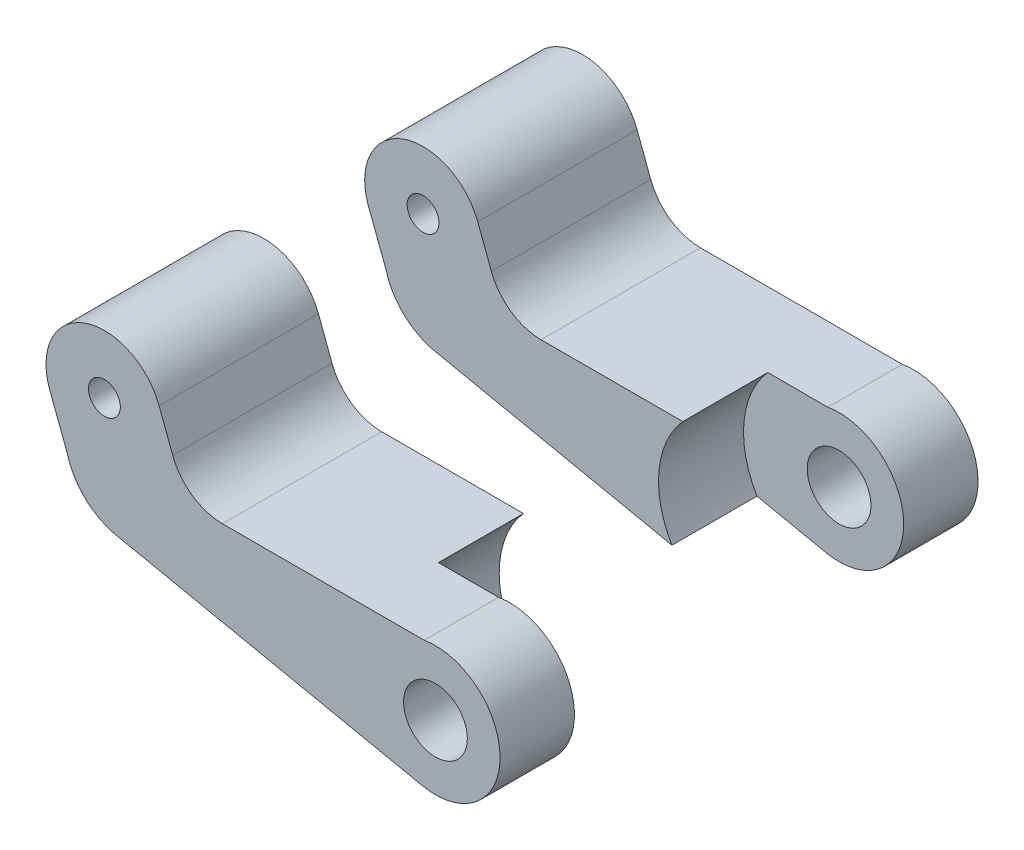
from build123d import *

# Parameters (mm, degrees)
BOSS_EXTRUDE2_DEPTH     = 15
SKETCH7_R               = 1.5
CUT_EXTRUDE1_DEPTH      = 18
CUT_EXTRUDE3_DEPTH      = 69
CUT_EXTRUDE3_DEPTH_BACK = 8
SKETCH12_R              = 9
CUT_EXTRUDE4_START      = -8
SKETCH13_R              = 9
CUT_EXTRUDE4_DEPTH      = 8
CUT_EXTRUDE5_DEPTH      = 10
CUT_EXTRUDE5_DEPTH_BACK = 48
SKETCH14_R              = 3


with BuildPart() as part:
    # Sketch3 → Boss-Extrude2 (new body)
    with BuildSketch(Plane.XY):
        with BuildLine():
            Line((-15.110783356, 40.907999924), (-13.834269034, 37.510363732))
            ThreePointArc((-13.834269034, 37.510363732), (-12.000412792, 35.158370297), (-9.15371136, 34.268880114))
            Line((-9.15371136, 34.268880114), (9.846529055, 34.268880114))
            ThreePointArc((9.846529055, 34.268880114), (16.986915334, 28.185418753), (9.662855904, 22.324380295))
            Line((9.662855904, 22.324380295), (-18.79366315, 28.260093131))
            ThreePointArc((-18.79366315, 28.260093131), (-21.953247193, 29.760673649), (-23.769791608, 32.749800546))
            Line((-23.769791608, 32.749800546), (-25.408010237, 37.039263884))
            ThreePointArc((-25.408010237, 37.039263884), (-22.193764817, 44.122245345), (-15.110783356, 40.907999924))
        make_face()
    extrude(amount=BOSS_EXTRUDE2_DEPTH)

    # Sketch7 → Cut-Extrude1 (cut)
    with BuildSketch(Plane.XY.offset(15)):
        with Locations((-20.259396796, 38.973631904)):
            Circle(SKETCH7_R)
    extrude(amount=-CUT_EXTRUDE1_DEPTH, mode=Mode.SUBTRACT)


with BuildPart() as body_2:
    # Body-Move/Copy1: copy of part
    add(part.part.moved(Location((0, 0, 30))))

    # Sketch13 → Cut-Extrude4 (cut)
    with BuildSketch(Plane(origin=(0, 0, 30), x_dir=(-1, 0, 0), z_dir=(0, 0, -1)).offset(CUT_EXTRUDE4_START)):
        with Locations((-10.904911352, 28.278943041)):
            Circle(SKETCH13_R)
    extrude(amount=CUT_EXTRUDE4_DEPTH, mode=Mode.SUBTRACT)


with BuildPart() as part_1:
    add(part.part)

    # Sketch12 → Cut-Extrude3 (cut, two sides: drawn at the far end of the back side and taken through both)
    with BuildSketch(Plane.XY.offset(15).offset(-CUT_EXTRUDE3_DEPTH_BACK)):
        with Locations((10.904911352, 28.278943041)):
            Circle(SKETCH12_R)
    extrude(amount=CUT_EXTRUDE3_DEPTH + CUT_EXTRUDE3_DEPTH_BACK, mode=Mode.SUBTRACT)


with BuildPart() as cut_extrude5_tool:
    # Sketch14 → Cut-Extrude5 (new, two sides: drawn at the far end of the back side and taken through both)
    with BuildSketch(Plane(origin=(0, 0, 0), x_dir=(-1, 0, 0), z_dir=(0, 0, -1)).offset(-CUT_EXTRUDE5_DEPTH_BACK)):
        with Locations(Location((-10.904911352, 28.278943041, 0), (0, 0, 180))):
            Circle(SKETCH14_R)
    extrude(amount=CUT_EXTRUDE5_DEPTH + CUT_EXTRUDE5_DEPTH_BACK)


with BuildPart() as part_2:
    add(part_1.part)

    # Cut-Extrude5: cut by cut_extrude5_tool
    add(cut_extrude5_tool.part, mode=Mode.SUBTRACT)


with BuildPart() as body_2_1:
    add(body_2.part)

    # Cut-Extrude5: cut by cut_extrude5_tool
    add(cut_extrude5_tool.part, mode=Mode.SUBTRACT)


solid = Compound([part_2.part, body_2_1.part])
